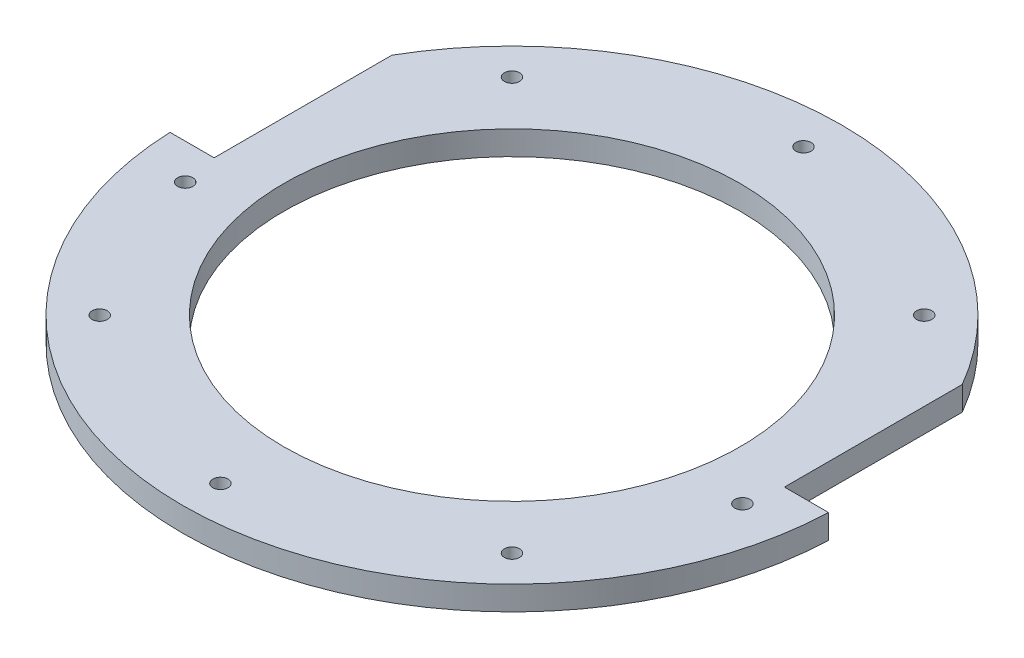
from build123d import *

# Parameters (mm, degrees)
SKETCH1_R           = 65
SKETCH1_R_2         = 1.5
SKETCH1_R_3         = 45
BOSS_EXTRUDE1_DEPTH = 4.75
SKETCH3_W           = 10
SKETCH3_H           = 5
CUT_EXTRUDE1_DEPTH  = 5
CUT_EXTRUDE2_DEPTH  = 93.012567076
SKETCH5_R           = 1.5
CUT_EXTRUDE3_DEPTH  = 93.012567076


with BuildPart() as part:
    # Sketch1 → Boss-Extrude1 (new body)
    with BuildSketch(Plane(origin=(0, 0, 0), x_dir=(1, 0, 0), z_dir=(0, 1, 0))):
        Circle(SKETCH1_R)
        with Locations((0, -57.5)):
            Circle(SKETCH1_R_2, mode=Mode.SUBTRACT)
        with Locations((40.658639918, -40.658639918)):
            Circle(SKETCH1_R_2, mode=Mode.SUBTRACT)
        with Locations((40.658639918, 40.658639918)):
            Circle(SKETCH1_R_2, mode=Mode.SUBTRACT)
        with Locations((0, 57.5)):
            Circle(SKETCH1_R_2, mode=Mode.SUBTRACT)
        with Locations((-40.658639918, 40.658639918)):
            Circle(SKETCH1_R_2, mode=Mode.SUBTRACT)
        with Locations((-40.658639918, -40.658639918)):
            Circle(SKETCH1_R_2, mode=Mode.SUBTRACT)
        Circle(SKETCH1_R_3, mode=Mode.SUBTRACT)
    extrude(amount=BOSS_EXTRUDE1_DEPTH)

    # Sketch3 → Cut-Extrude1 (cut)
    with BuildSketch(Plane(origin=(0, 4.75, 0), x_dir=(1, 0, 0), z_dir=(0, 1, 0))):
        with Locations((61.25, 0)):
            Rectangle(SKETCH3_W, SKETCH3_H)
        with Locations((-61.25, 0)):
            Rectangle(SKETCH3_W, SKETCH3_H)
    extrude(amount=-CUT_EXTRUDE1_DEPTH, mode=Mode.SUBTRACT)

    # Sketch4 → Cut-Extrude2 (cut, through all)
    with BuildSketch(Plane(origin=(0, 4.75, 0), x_dir=(1, 0, 0), z_dir=(0, 1, 0))):
        with BuildLine():
            Line((-64.951905284, 2.5), (-56.25, 2.5))
            Line((-56.25, 2.5), (-56.25, 32.572035552))
            ThreePointArc((-56.25, 32.572035552), (-62.438428004, 18.067725599), (-64.951905284, 2.5))
        make_face()
        with BuildLine():
            ThreePointArc((64.951905284, 2.5), (62.438428004, 18.067725599), (56.25, 32.572035552))
            Line((56.25, 32.572035552), (56.25, 2.5))
            Line((56.25, 2.5), (64.951905284, 2.5))
        make_face()
    extrude(amount=-CUT_EXTRUDE2_DEPTH, mode=Mode.SUBTRACT)

    # Sketch5 → Cut-Extrude3 (cut, through all)
    with BuildSketch(Plane.XZ):
        with Locations((54.951905284, 9.5)):
            Circle(SKETCH5_R)
        with Locations((-54.951905284, 9.5)):
            Circle(SKETCH5_R)
    extrude(amount=-CUT_EXTRUDE3_DEPTH, mode=Mode.SUBTRACT)


solid = part.part
